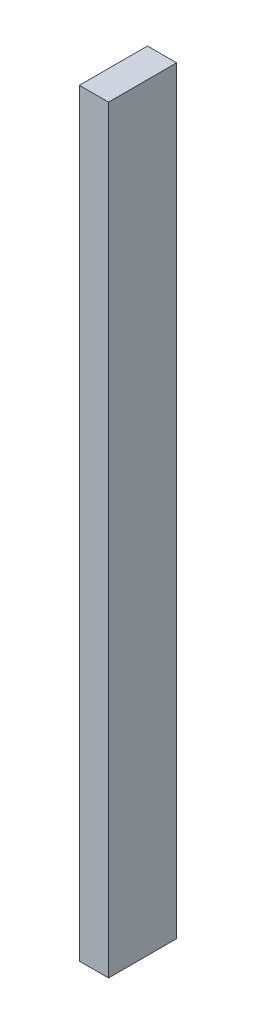
from build123d import *

# Parameters (mm, degrees)
SKETCH1_W           = 38.1
SKETCH1_H           = 88.9
BOSS_EXTRUDE1_DEPTH = 495.3


with BuildPart() as part:
    # Sketch1 → Boss-Extrude1 (new, symmetric)
    with BuildSketch(Plane(origin=(0, 0, 0), x_dir=(1, 0, 0), z_dir=(0, 1, 0))):
        Rectangle(SKETCH1_W, SKETCH1_H)
    extrude(amount=BOSS_EXTRUDE1_DEPTH, both=True)


solid = part.part
